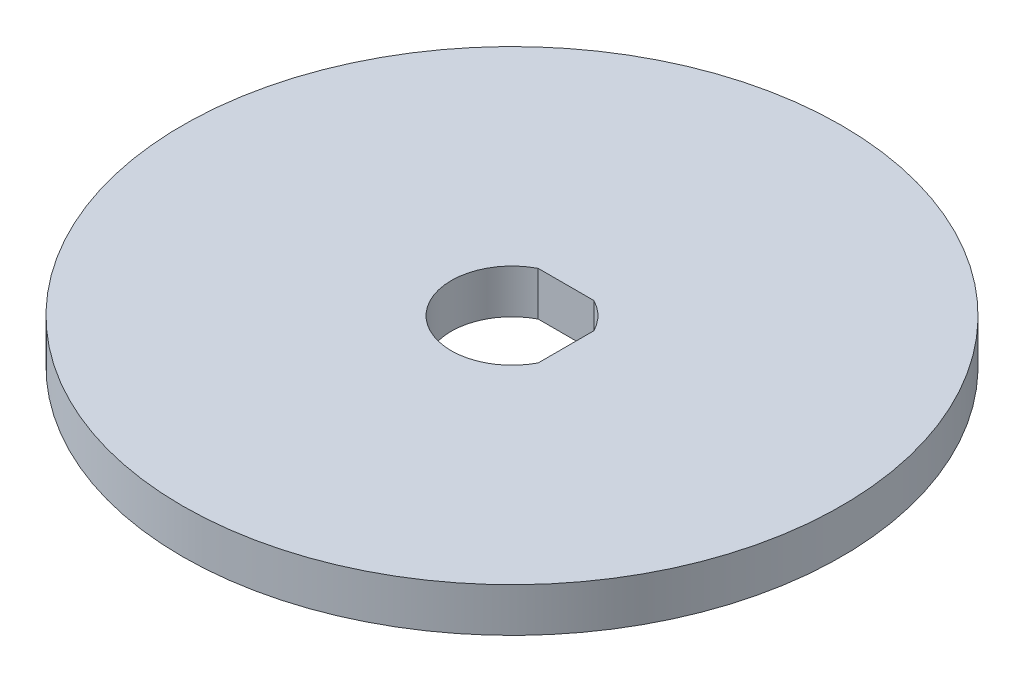
from build123d import *

# Parameters (mm, degrees)
SKETCH_1_R      = 22.5
EXTRUDE_1_DEPTH = 3
SKETCH_2_R      = 1.4
EXTRUDE_2_DEPTH = 3


with BuildPart() as part:
    # Эскиз1 → Вытянуть1 (new body)
    with BuildSketch(Plane(origin=(0, 0, 0), x_dir=(1, 0, 0), z_dir=(0, 1, 0))):
        with Locations(Location((0, 0, 0), (0, 0, 270))):
            Circle(SKETCH_1_R)
        with BuildLine():
            Line((1.9, 3.689512163), (-1.9, 3.689512163))
            ThreePointArc((-1.9, 3.689512163), (-2.934493142, -2.934493142), (3.689512163, -1.9))
            Line((3.689512163, -1.9), (3.689512163, 1.9))
            ThreePointArc((3.689512163, 1.9), (2.934493142, 2.934493142), (1.9, 3.689512163))
        make_face(mode=Mode.SUBTRACT)
    extrude(amount=EXTRUDE_1_DEPTH)

    # Эскиз2 → Вытянуть2 (add)
    with BuildSketch(Plane.XZ):
        with Locations(Location((0, 12.5, 0), (0, 0, 90))):
            Circle(SKETCH_2_R)
        with Locations(Location((0, -12.5, 0), (0, 0, 90))):
            Circle(SKETCH_2_R)
    extrude(amount=EXTRUDE_2_DEPTH)


solid = part.part
